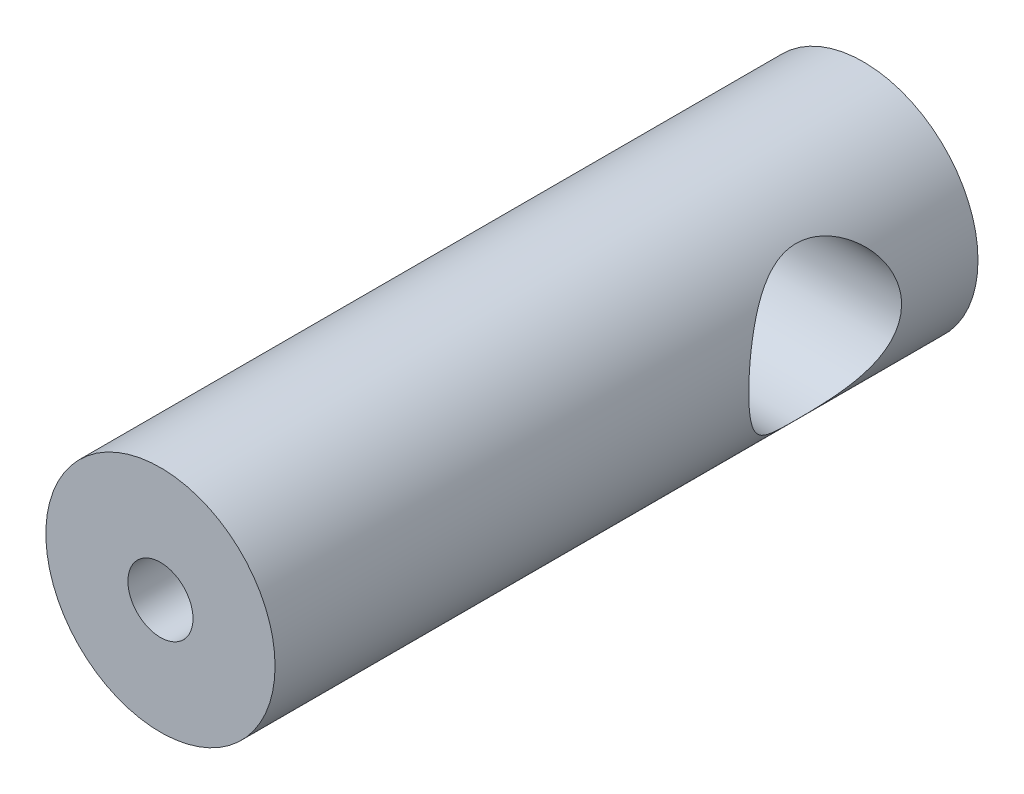
from build123d import *

# Parameters (mm, degrees)
SKETCH1_R                 = 4.7625
BOSS_EXTRUDE1_DEPTH       = 29.21
CUT_EXTRUDE2_DEPTH        = 30.97643929
CUT_EXTRUDE2_DEPTH_BACK   = 30.97643929
SKETCH3_R                 = 3.175
F_6_32_TAPPED_HOLE1_D     = 2.7051
F_6_32_TAPPED_HOLE1_DEPTH = 12.7
F_6_32_TAPPED_HOLE1_TIP   = 0.81269403


with BuildPart() as part:
    # Sketch1 → Boss-Extrude1 (new body)
    with BuildSketch(Plane.XY):
        Circle(SKETCH1_R)
    extrude(amount=BOSS_EXTRUDE1_DEPTH)

    # Sketch3 → Cut-Extrude2 (cut, two sides: drawn at the far end of the back side and taken through both)
    with BuildSketch(Plane(origin=(0, 0, 0), x_dir=(0, 0, -1), z_dir=(1, 0, 0)).offset(-CUT_EXTRUDE2_DEPTH_BACK)):
        with Locations((-6.35, 0)):
            Circle(SKETCH3_R)
    extrude(amount=CUT_EXTRUDE2_DEPTH + CUT_EXTRUDE2_DEPTH_BACK, mode=Mode.SUBTRACT)

    # #6-32 Tapped Hole1
    with Locations(Plane.XY.offset(29.21)):
        with Locations((0, 0)):
            Hole(F_6_32_TAPPED_HOLE1_D / 2, depth=F_6_32_TAPPED_HOLE1_DEPTH)
            with Locations((0, 0, -(F_6_32_TAPPED_HOLE1_DEPTH + F_6_32_TAPPED_HOLE1_TIP / 2))):  # 118° drill point
                Cone(0, F_6_32_TAPPED_HOLE1_D / 2, F_6_32_TAPPED_HOLE1_TIP, mode=Mode.SUBTRACT)


solid = part.part
